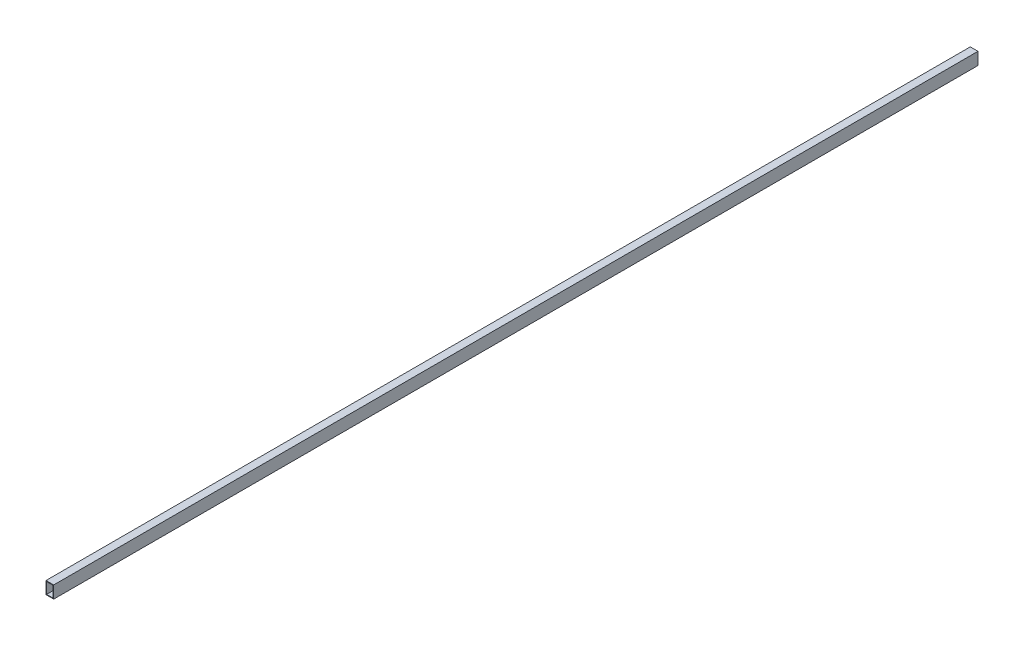
from build123d import *

# Parameters (mm, degrees)
SKETCH1_W           = 50
SKETCH1_H           = 80
BOSS_EXTRUDE1_DEPTH = 6000
SKETCH2_W           = 42
SKETCH2_H           = 72
CUT_EXTRUDE1_DEPTH  = 6000


with BuildPart() as part:
    # Sketch1 → Boss-Extrude1 (new body)
    with BuildSketch(Plane.XY):
        Rectangle(SKETCH1_W, SKETCH1_H)
    extrude(amount=BOSS_EXTRUDE1_DEPTH)

    # Sketch2 → Cut-Extrude1 (cut)
    with BuildSketch(Plane(origin=(0, 0, 0), x_dir=(-1, 0, 0), z_dir=(0, 0, -1))):
        Rectangle(SKETCH2_W, SKETCH2_H)
    extrude(amount=-CUT_EXTRUDE1_DEPTH, mode=Mode.SUBTRACT)


solid = part.part
